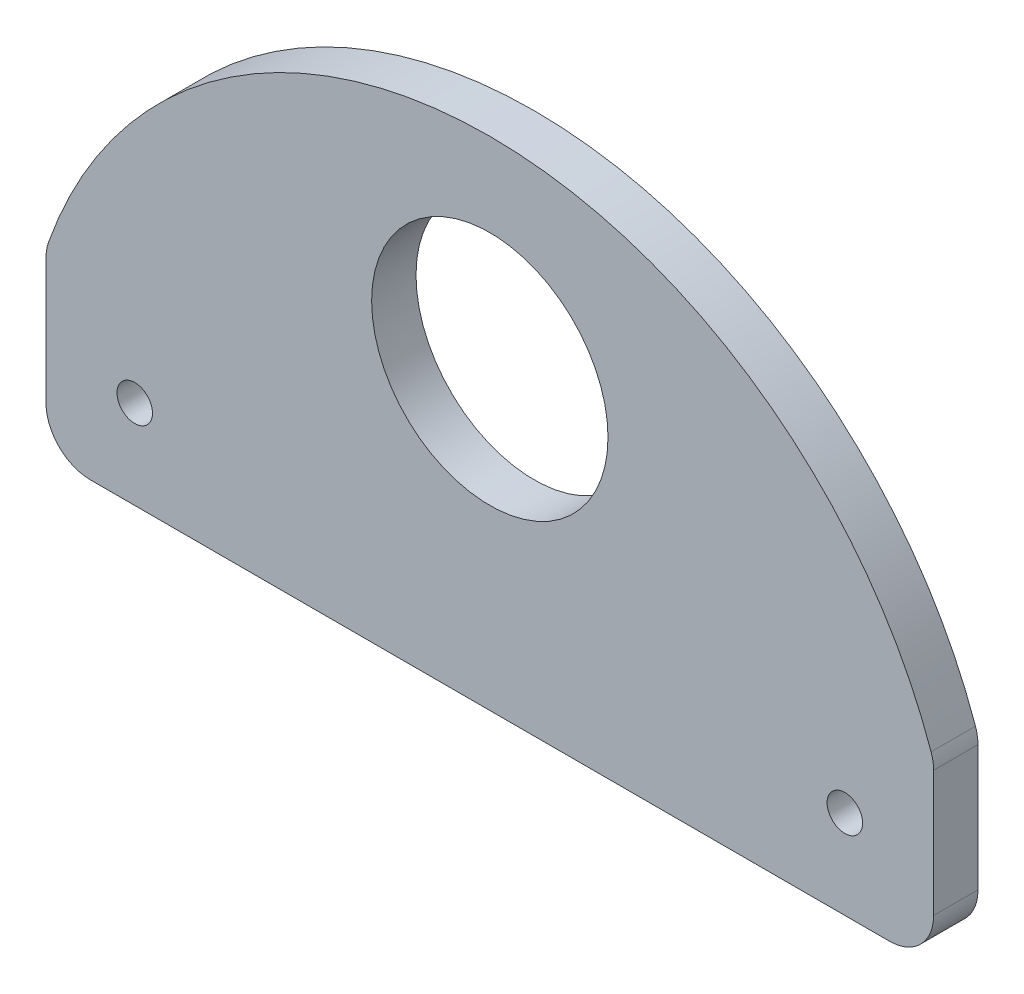
from build123d import *

# Parameters (mm, degrees)
ESQUISSE2_R        = 2
ESQUISSE2_R_2      = 13.315
BOSS_EXTRU_1_DEPTH = 5
CONG_1_R           = 5


with BuildPart() as part:
    # Esquisse2 → Boss.-Extru.1 (new body)
    with BuildSketch(Plane.XY):
        with BuildLine():
            Line((-50, 20), (-50, 0))
            Line((-50, 0), (50, 0))
            Line((50, 0), (50, 20))
            ThreePointArc((50, 20), (0, 56.025428048), (-50, 20))
        make_face()
        with Locations((-40, 10)):
            Circle(ESQUISSE2_R, mode=Mode.SUBTRACT)
        with Locations(Location((40, 10, 0), (0, 0, 180))):
            Circle(ESQUISSE2_R, mode=Mode.SUBTRACT)
        with Locations((0, 33.315)):
            Circle(ESQUISSE2_R_2, mode=Mode.SUBTRACT)
    extrude(amount=BOSS_EXTRU_1_DEPTH)

    # Congé1
    cong_1_edges = [part.edges().sort_by_distance(p)[0] for p in [
        (50, 20, 2.5),
        (50, 0, 2.5),
        (-50, 0, 2.5),
        (-50, 20, 2.5),
    ]]
    fillet(cong_1_edges, radius=CONG_1_R)


solid = part.part
